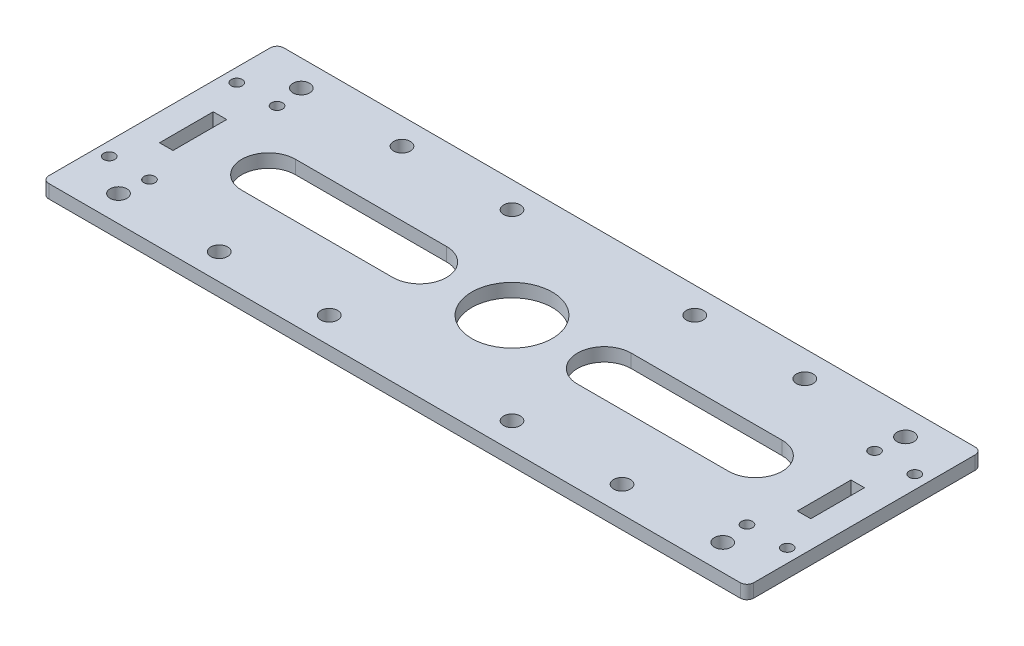
from build123d import *

# Parameters (mm, degrees)
SKETCH_1_W          = 210
SKETCH_1_H          = 70
EXTRUDE_1_DEPTH     = 4
SKETCH_2_R          = 1.65
CUT_EXTRUDE_1_DEPTH = 50
SKETCH_3_W          = 4
SKETCH_3_H          = 16
CUT_EXTRUDE_2_DEPTH = 50
FILLET_1_R          = 2
SKETCH_7_R          = 2.5
CUT_EXTRUDE_4_DEPTH = 100
SKETCH_8_R          = 12
CUT_EXTRUDE_5_DEPTH = 10
CUT_EXTRUDE_6_DEPTH = 10
SKETCH_10_R         = 2.5
CUT_EXTRUDE_7_DEPTH = 10


with BuildPart() as part:
    # 草图1 → 凸台-拉伸1 (new body)
    with BuildSketch(Plane(origin=(0, 0, 0), x_dir=(1, 0, 0), z_dir=(0, 1, 0))):
        Rectangle(SKETCH_1_W, SKETCH_1_H)
    extrude(amount=EXTRUDE_1_DEPTH)

    # 草图2 → 切除-拉伸1 (cut)
    with BuildSketch(Plane(origin=(0, 4, 0), x_dir=(1, 0, 0), z_dir=(0, 1, 0))):
        with Locations(Location((101, 19, 0), (0, 0, 270))):
            Circle(SKETCH_2_R)
        with Locations(Location((101, -19, 0), (0, 0, 270))):
            Circle(SKETCH_2_R)
        with Locations(Location((-101, -19, 0), (0, 0, 270))):
            Circle(SKETCH_2_R)
        with Locations(Location((-101, 19, 0), (0, 0, 270))):
            Circle(SKETCH_2_R)
        with Locations(Location((89, 19, 0), (0, 0, 270))):
            Circle(SKETCH_2_R)
        with Locations(Location((89, -19, 0), (0, 0, 270))):
            Circle(SKETCH_2_R)
        with Locations(Location((-89, -19, 0), (0, 0, 270))):
            Circle(SKETCH_2_R)
        with Locations(Location((-89, 19, 0), (0, 0, 270))):
            Circle(SKETCH_2_R)
    extrude(amount=-CUT_EXTRUDE_1_DEPTH, mode=Mode.SUBTRACT)

    # 草图3 → 切除-拉伸2 (cut)
    with BuildSketch(Plane(origin=(0, 4, 0), x_dir=(1, 0, 0), z_dir=(0, 1, 0))):
        with Locations((95, 0)):
            Rectangle(SKETCH_3_W, SKETCH_3_H)
        with Locations((-95, 0)):
            Rectangle(SKETCH_3_W, SKETCH_3_H)
    extrude(amount=-CUT_EXTRUDE_2_DEPTH, mode=Mode.SUBTRACT)

    # 圆角1
    fillet_1_edges = [part.edges().sort_by_distance(p)[0] for p in [
        (105, 2, 35),
        (-105, 2, 35),
        (-105, 2, -35),
        (105, 2, -35),
    ]]
    fillet(fillet_1_edges, radius=FILLET_1_R)

    # 草图7 → 切除-拉伸4 (cut)
    with BuildSketch(Plane(origin=(0, 4, 0), x_dir=(1, 0, 0), z_dir=(0, 1, 0))):
        with Locations(Location((27.223611076, 27.223611076, 0), (0, 0, 270))):
            Circle(SKETCH_7_R)
        with Locations(Location((-27.223611076, 27.223611076, 0), (0, 0, 270))):
            Circle(SKETCH_7_R)
        with Locations(Location((27.223611076, -27.223611076, 0), (0, 0, 270))):
            Circle(SKETCH_7_R)
        with Locations(Location((-27.223611076, -27.223611076, 0), (0, 0, 270))):
            Circle(SKETCH_7_R)
    extrude(amount=-CUT_EXTRUDE_4_DEPTH, mode=Mode.SUBTRACT)

    # 草图8 → 切除-拉伸5 (cut)
    with BuildSketch(Plane(origin=(0, 4, 0), x_dir=(1, 0, 0), z_dir=(0, 1, 0))):
        with Locations(Location((0, 0, 0), (0, 0, 270))):
            Circle(SKETCH_8_R)
    extrude(amount=-CUT_EXTRUDE_5_DEPTH, mode=Mode.SUBTRACT)

    # 草图9 → 切除-拉伸6 (cut)
    with BuildSketch(Plane(origin=(0, 4, 0), x_dir=(1, 0, 0), z_dir=(0, 1, 0))):
        with BuildLine():
            Line((27.5, 8), (72.5, 8))
            ThreePointArc((72.5, 8), (80.5, 0), (72.5, -8))
            Line((72.5, -8), (27.5, -8))
            ThreePointArc((27.5, -8), (19.5, 0), (27.5, 8))
        make_face()
        with BuildLine():
            Line((-27.5, 8), (-72.5, 8))
            ThreePointArc((-72.5, 8), (-80.5, 0), (-72.5, -8))
            Line((-72.5, -8), (-27.5, -8))
            ThreePointArc((-27.5, -8), (-19.5, 0), (-27.5, 8))
        make_face()
    extrude(amount=-CUT_EXTRUDE_6_DEPTH, mode=Mode.SUBTRACT)

    # 草图10 → 切除-拉伸7 (cut)
    with BuildSketch(Plane(origin=(0, 4, 0), x_dir=(1, 0, 0), z_dir=(0, 1, 0))):
        with Locations(Location((-90, -27.223611076, 0), (0, 0, 270))):
            Circle(SKETCH_10_R)
        with Locations(Location((-60, -27.223611076, 0), (0, 0, 270))):
            Circle(SKETCH_10_R)
        with Locations(Location((60, -27.223611076, 0), (0, 0, 270))):
            Circle(SKETCH_10_R)
        with Locations(Location((90, -27.223611076, 0), (0, 0, 270))):
            Circle(SKETCH_10_R)
        with Locations(Location((90, 27.223611076, 0), (0, 0, 270))):
            Circle(SKETCH_10_R)
        with Locations(Location((60, 27.223611076, 0), (0, 0, 270))):
            Circle(SKETCH_10_R)
        with Locations(Location((-60, 27.223611076, 0), (0, 0, 270))):
            Circle(SKETCH_10_R)
        with Locations(Location((-90, 27.223611076, 0), (0, 0, 270))):
            Circle(SKETCH_10_R)
    extrude(amount=-CUT_EXTRUDE_7_DEPTH, mode=Mode.SUBTRACT)


solid = part.part
